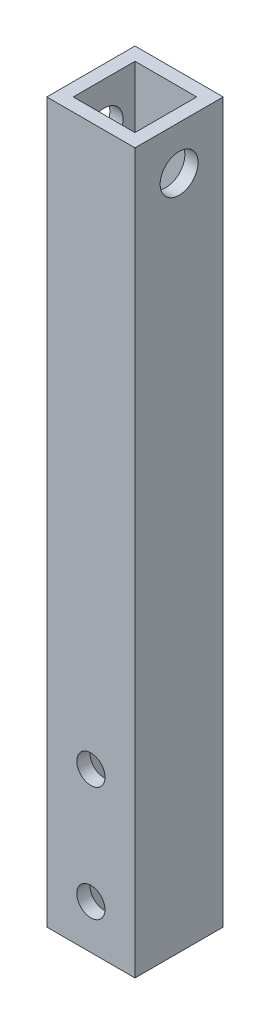
from build123d import *

# Parameters (mm, degrees)
SKETCH_1_W          = 10
SKETCH_1_H          = 10
SKETCH_1_W_2        = 7
SKETCH_1_H_2        = 7
EXTRUDE_1_DEPTH     = 81.5
SKETCH_2_R          = 1.6
CUT_EXTRUDE_1_DEPTH = 83.263296798
SKETCH_3_R          = 2.15
CUT_EXTRUDE_2_DEPTH = 83.263296798


with BuildPart() as part:
    # ｽｹｯﾁ1 → 押し出し-薄板1 (new body)
    with BuildSketch(Plane(origin=(0, 0, 0), x_dir=(1, 0, 0), z_dir=(0, 1, 0))):
        Rectangle(SKETCH_1_W, SKETCH_1_H)
        Rectangle(SKETCH_1_W_2, SKETCH_1_H_2, mode=Mode.SUBTRACT)
    extrude(amount=EXTRUDE_1_DEPTH)

    # ｽｹｯﾁ2 → ｶｯﾄ - 押し出し1 (cut, through all)
    with BuildSketch(Plane.XY.offset(5)):
        with Locations((0, 18)):
            Circle(SKETCH_2_R)
        with Locations((0, 5)):
            Circle(SKETCH_2_R)
    extrude(amount=-CUT_EXTRUDE_1_DEPTH, mode=Mode.SUBTRACT)

    # ｽｹｯﾁ3 → ｶｯﾄ - 押し出し2 (cut, through all)
    with BuildSketch(Plane(origin=(5, 0, 0), x_dir=(0, 0, -1), z_dir=(1, 0, 0))):
        with Locations((0, 76.5)):
            Circle(SKETCH_3_R)
    extrude(amount=-CUT_EXTRUDE_2_DEPTH, mode=Mode.SUBTRACT)


solid = part.part
